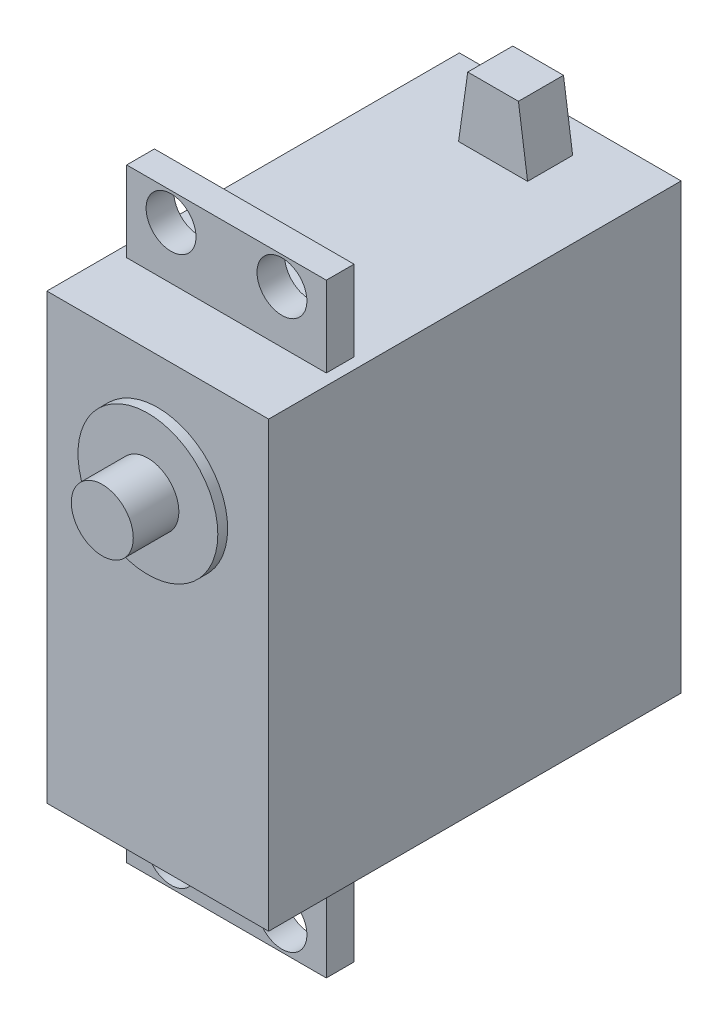
from build123d import *

# Parameters (mm, degrees)
SKETCH1_W           = 20
SKETCH1_H           = 40
BOSS_EXTRUDE1_DEPTH = 8.7
SKETCH2_W           = 20
SKETCH2_H           = 40
BOSS_EXTRUDE2_DEPTH = 28.5
SKETCH3_R           = 2.25
BOSS_EXTRUDE3_DEPTH = 2.5
SKETCH4_R           = 2.794
BOSS_EXTRUDE4_DEPTH = 5
BOSS_EXTRUDE6_DEPTH = 6.9596
SKETCH10_R          = 6.30555
BOSS_EXTRUDE7_DEPTH = 0.889
CUT_EXTRUDE1_DEPTH  = 2.8956


with BuildPart() as part:
    # Sketch1 → Boss-Extrude1 (new body)
    with BuildSketch(Plane.XY):
        with Locations((10, 20)):
            Rectangle(SKETCH1_W, SKETCH1_H)
    extrude(amount=BOSS_EXTRUDE1_DEPTH)

    # Sketch2 → Boss-Extrude2 (add)
    with BuildSketch(Plane(origin=(0, 0, 0), x_dir=(-1, 0, 0), z_dir=(0, 0, -1))):
        with Locations((-10, 20)):
            Rectangle(SKETCH2_W, SKETCH2_H)
    extrude(amount=BOSS_EXTRUDE2_DEPTH)

    # Sketch3 → Boss-Extrude3 (add)
    with BuildSketch(Plane.XY):
        Polygon((19, 0), (19, -7.25), (1, -7.25), (1, 0), (0, 0), (0, 40), (1, 40), (1, 47.25), (19, 47.25), (19, 40), (20, 40), (20, 0), align=None)
        with Locations((5, -4.75)):
            Circle(SKETCH3_R, mode=Mode.SUBTRACT)
        with Locations((15, -4.75)):
            Circle(SKETCH3_R, mode=Mode.SUBTRACT)
        with Locations((5, 44.75)):
            Circle(SKETCH3_R, mode=Mode.SUBTRACT)
        with Locations((15, 44.75)):
            Circle(SKETCH3_R, mode=Mode.SUBTRACT)
    extrude(amount=BOSS_EXTRUDE3_DEPTH)

    # Sketch4 → Boss-Extrude4 (add)
    with BuildSketch(Plane.XY.offset(8.7)):
        with Locations((10, 29.6)):
            Circle(SKETCH4_R)
    extrude(amount=BOSS_EXTRUDE4_DEPTH)

    # Sketch9 → Boss-Extrude6 (add)
    with BuildSketch(Plane(origin=(0, 0, -28.5), x_dir=(-1, 0, 0), z_dir=(0, 0, -1))):
        Polygon((-13.1115, 40), (-6.8885, 40), (-7.714, 45.842), (-12.286, 45.842), align=None)
    extrude(amount=-BOSS_EXTRUDE6_DEPTH)

    # Sketch10 → Boss-Extrude7 (add)
    with BuildSketch(Plane.XY.offset(8.7)):
        with Locations((10, 29.6)):
            Circle(SKETCH10_R)
    extrude(amount=BOSS_EXTRUDE7_DEPTH)

    # Sketch11 → Cut-Extrude1 (cut)
    with BuildSketch(Plane(origin=(0, 0, -28.5), x_dir=(-1, 0, 0), z_dir=(0, 0, -1))):
        Polygon((-12.286, 45.842), (-7.714, 45.842), (-6.8885, 40), (-13.1115, 40), align=None)
    extrude(amount=-CUT_EXTRUDE1_DEPTH, mode=Mode.SUBTRACT)


solid = part.part
